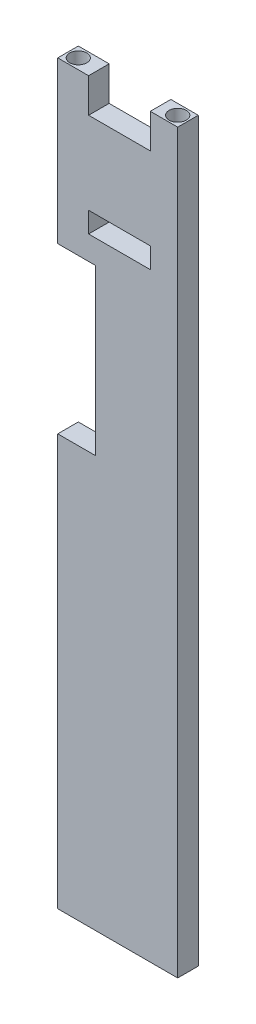
from build123d import *

# Parameters (mm, degrees)
ESQUISSE1_W                = 35
ESQUISSE1_H                = 215
BOSS_EXTRU_1_DEPTH         = 6
ESQUISSE2_W                = 18
ESQUISSE2_H                = 6
ENL_V_MAT_EXTRU_1_DEPTH    = 10
ESQUISSE3_W                = 18
ESQUISSE3_H                = 6
ENL_V_MAT_EXTRU_2_DEPTH    = 218.912826607
ESQUISSE4_W                = 11
ESQUISSE4_H                = 48.05464589
ENL_V_MAT_EXTRU_3_DEPTH    = 218.912826607
ESQUISSE5_R                = 2.5
ENL_V_MAT_EXTRU_4_DEPTH    = 10
R_P_TITION_LIN_AIRE1_COUNT = 2
R_P_TITION_LIN_AIRE1_PITCH = 29


with BuildPart() as part:
    # Esquisse1 → Boss.-Extru.1 (new body)
    with BuildSketch(Plane.XY):
        with Locations((17.5, 107.5)):
            Rectangle(ESQUISSE1_W, ESQUISSE1_H)
    extrude(amount=BOSS_EXTRU_1_DEPTH)

    # Esquisse2 → Enlèv. mat.-Extru.1 (cut)
    with BuildSketch(Plane(origin=(0, 215, 0), x_dir=(1, 0, 0), z_dir=(0, 1, 0))):
        with Locations((18, -3)):
            Rectangle(ESQUISSE2_W, ESQUISSE2_H)
    extrude(amount=-ENL_V_MAT_EXTRU_1_DEPTH, mode=Mode.SUBTRACT)

    # Esquisse3 → Enlèv. mat.-Extru.2 (cut, through all)
    with BuildSketch(Plane.XY.offset(6)):
        with Locations((18, 178)):
            Rectangle(ESQUISSE3_W, ESQUISSE3_H)
    extrude(amount=-ENL_V_MAT_EXTRU_2_DEPTH, mode=Mode.SUBTRACT)

    # Esquisse4 → Enlèv. mat.-Extru.3 (cut, through all)
    with BuildSketch(Plane(origin=(0, 0, 0), x_dir=(-1, 0, 0), z_dir=(0, 0, -1))):
        with Locations((-5.5, 144.027326709)):
            Rectangle(ESQUISSE4_W, ESQUISSE4_H)
    extrude(amount=-ENL_V_MAT_EXTRU_3_DEPTH, mode=Mode.SUBTRACT)

    # Esquisse5 → Enlèv. mat.-Extru.4 (cut)
    with BuildSketch(Plane(origin=(0, 215, 0), x_dir=(1, 0, 0), z_dir=(0, 1, 0))):
        with Locations(Location((3, -3, 0), (0, 0, 270))):
            Circle(ESQUISSE5_R)
    enl_v_mat_extru_4 = extrude(amount=-ENL_V_MAT_EXTRU_4_DEPTH, mode=Mode.SUBTRACT)

    # Répétition linéaire1: Enlèv. mat.-Extru.4 ×2
    with Locations(*[(i * R_P_TITION_LIN_AIRE1_PITCH, 0, 0) for i in range(1, R_P_TITION_LIN_AIRE1_COUNT)]):
        add(enl_v_mat_extru_4, mode=Mode.SUBTRACT)


solid = part.part
